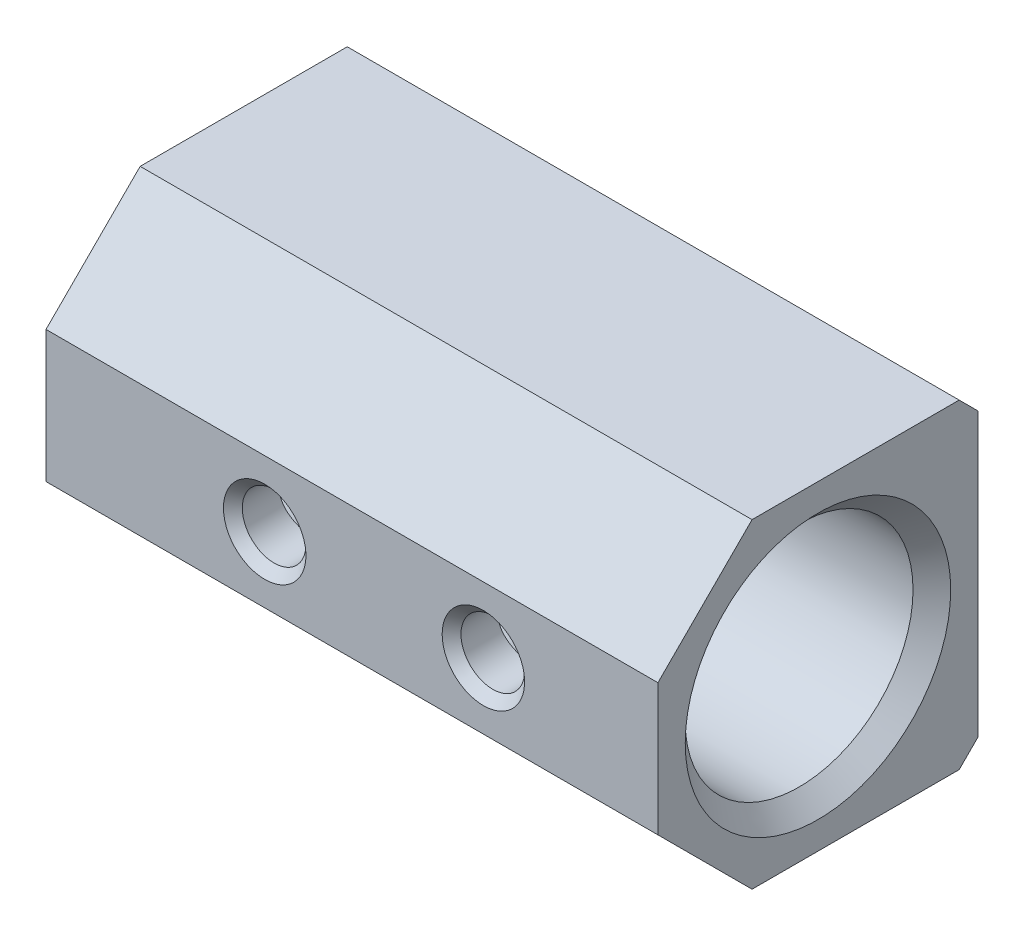
from build123d import *

# Parameters (mm, degrees)
SKETCH2_W           = 65
SKETCH2_H           = 34
BOSS_EXTRUDE1_DEPTH = 34
CHAMFER1_SIZE       = 10
CHAMFER2_SIZE       = 2
SKETCH3_R           = 12.1
CUT_EXTRUDE1_DEPTH  = 76.299402388
CHAMFER3_SIZE       = 2
SKETCH4_R           = 3.38
CUT_EXTRUDE2_DEPTH  = 51.012498438
CHAMFER4_SIZE       = 1


with BuildPart() as part:
    # Sketch2 → Boss-Extrude1 (new body)
    with BuildSketch(Plane.XY):
        Rectangle(SKETCH2_W, SKETCH2_H)
    extrude(amount=BOSS_EXTRUDE1_DEPTH)

    # Chamfer1
    chamfer1_edges = [part.edges().sort_by_distance(p)[0] for p in [
        (0, -17, 34),
        (0, 17, 34),
    ]]
    chamfer(chamfer1_edges, length=CHAMFER1_SIZE)

    # Chamfer2
    chamfer2_edges = [part.edges().sort_by_distance(p)[0] for p in [
        (0, -17, 0),
        (0, 17, 0),
    ]]
    chamfer(chamfer2_edges, length=CHAMFER2_SIZE)

    # Sketch3 → Cut-Extrude1 (cut, through all)
    with BuildSketch(Plane(origin=(32.5, 0, 0), x_dir=(0, 0, -1), z_dir=(1, 0, 0))):
        with Locations((-17, 0)):
            Circle(SKETCH3_R)
    extrude(amount=-CUT_EXTRUDE1_DEPTH, mode=Mode.SUBTRACT)

    # Chamfer3
    chamfer3_edges = [part.edges().sort_by_distance(p)[0] for p in [
        (32.5, 0, 29.1),
    ]]
    chamfer(chamfer3_edges, length=CHAMFER3_SIZE)

    # Sketch4 → Cut-Extrude2 (cut, through all)
    with BuildSketch(Plane.XY.offset(34)):
        with Locations((-9.27, 0)):
            Circle(SKETCH4_R)
        with Locations((13.96, 0)):
            Circle(SKETCH4_R)
    extrude(amount=-CUT_EXTRUDE2_DEPTH, mode=Mode.SUBTRACT)

    # Chamfer4
    chamfer4_edges = [part.edges().sort_by_distance(p)[0] for p in [
        (-12.65, 0, 0),
        (-12.65, 0, 34),
        (10.58, 0, 0),
        (10.58, 0, 34),
    ]]
    chamfer(chamfer4_edges, length=CHAMFER4_SIZE)


solid = part.part
